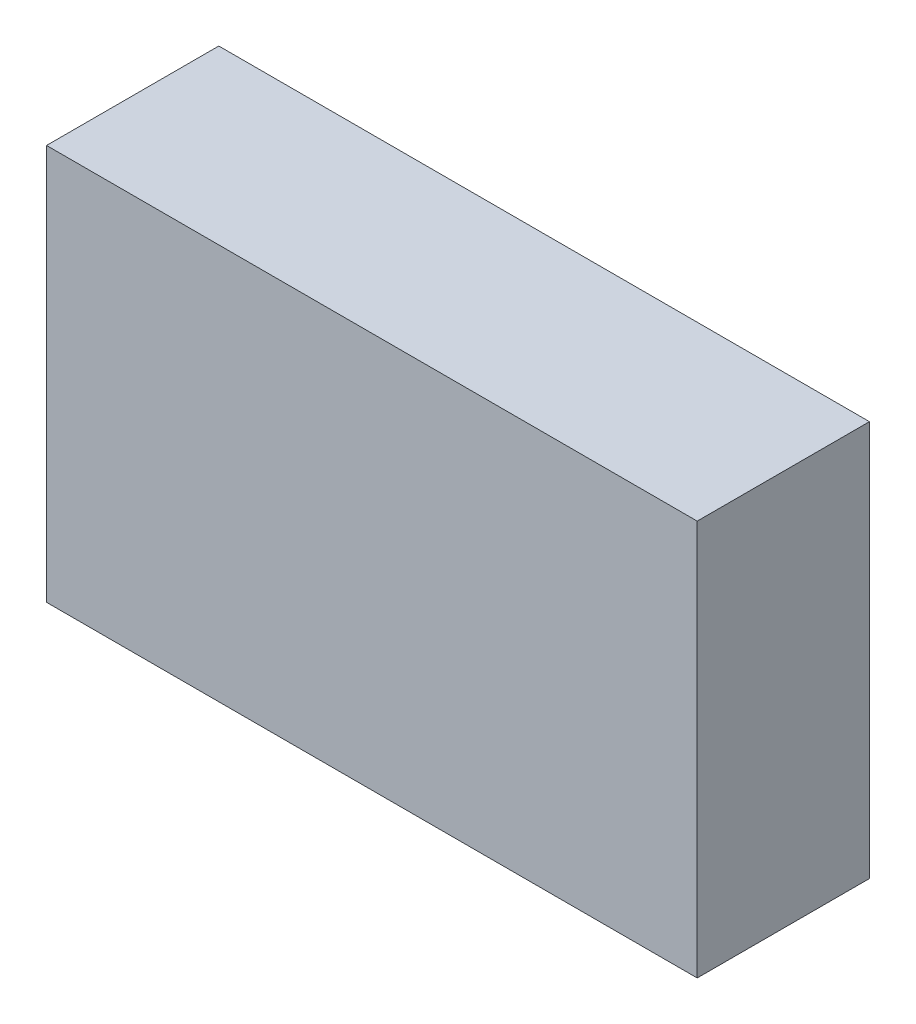
from build123d import *

# Parameters (mm, degrees)
CURVESKETCH_W   = 29.137
CURVESKETCH_H   = 17.719
CURVEBOSS_DEPTH = 7.713


with BuildPart() as part:
    # CurveSketch → CurveBoss (new body)
    with BuildSketch(Plane.XY):
        with Locations((-7.391, 11.173)):
            Rectangle(CURVESKETCH_W, CURVESKETCH_H)
    extrude(amount=CURVEBOSS_DEPTH)


solid = part.part
